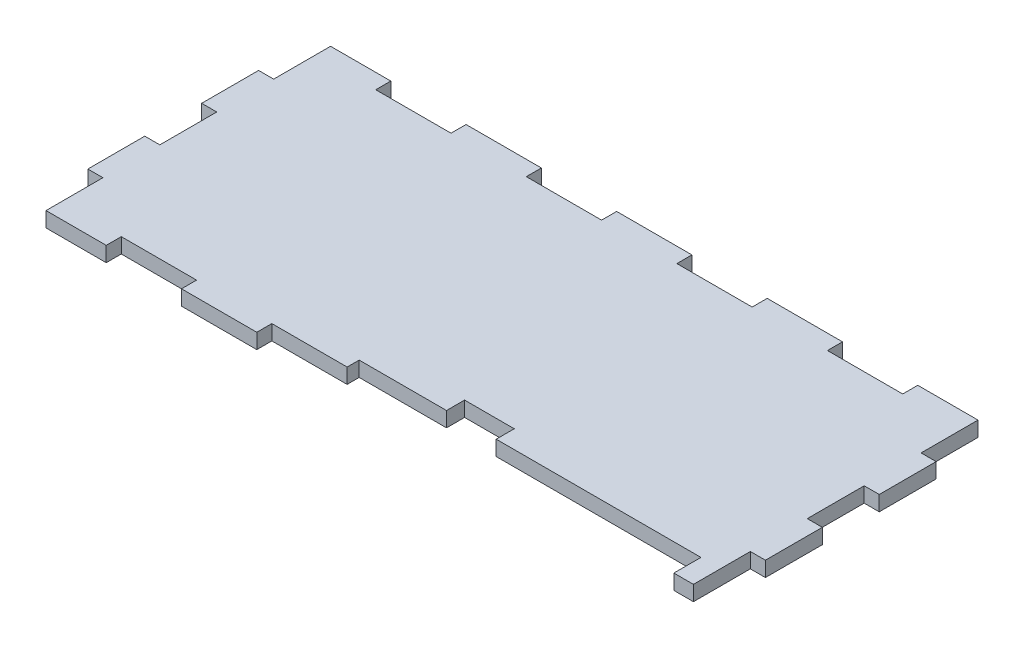
from build123d import *

# Parameters (mm, degrees)
SKETCH1_W           = 114.3
SKETCH1_H           = 48.006
BOSS_EXTRUDE1_DEPTH = 2.54
CUT_EXTRUDE2_REACH  = 64.038
SKETCH2_W           = 2.54
SKETCH2_H           = 9.6012
SKETCH2_W_2         = 12.7
SKETCH2_H_2         = 2.54
CUT_EXTRUDE3_DEPTH  = 2.54


with BuildPart() as part:
    # Sketch1 → Boss-Extrude1 (new body)
    with BuildSketch(Plane(origin=(0, 0, 0), x_dir=(1, 0, 0), z_dir=(0, 1, 0))):
        Rectangle(SKETCH1_W, SKETCH1_H)
    extrude(amount=BOSS_EXTRUDE1_DEPTH)

    # Sketch2 → Cut-Extrude2 (cut, up to next)
    with BuildSketch(Plane(origin=(0, 2.54, 0), x_dir=(1, 0, 0), z_dir=(0, 1, 0)), mode=Mode.PRIVATE) as cut_extrude2_sk1:
        with Locations((-55.88, 19.2024)):
            Rectangle(SKETCH2_W, SKETCH2_H)
    cut_extrude2_tool1 = extrude(cut_extrude2_sk1.sketch, amount=-CUT_EXTRUDE2_REACH, mode=Mode.PRIVATE) & part.part
    # Sketch2 → Cut-Extrude2 (cut, up to next)
    with BuildSketch(Plane(origin=(0, 2.54, 0), x_dir=(1, 0, 0), z_dir=(0, 1, 0)), mode=Mode.PRIVATE) as cut_extrude2_sk2:
        with Locations((-38.1, 22.733)):
            Rectangle(SKETCH2_W_2, SKETCH2_H_2)
    cut_extrude2_tool2 = extrude(cut_extrude2_sk2.sketch, amount=-CUT_EXTRUDE2_REACH, mode=Mode.PRIVATE) & part.part
    # Sketch2 → Cut-Extrude2 (cut, up to next)
    with BuildSketch(Plane(origin=(0, 2.54, 0), x_dir=(1, 0, 0), z_dir=(0, 1, 0)), mode=Mode.PRIVATE) as cut_extrude2_sk3:
        with Locations((-12.7, 22.733)):
            Rectangle(SKETCH2_W_2, SKETCH2_H_2)
    cut_extrude2_tool3 = extrude(cut_extrude2_sk3.sketch, amount=-CUT_EXTRUDE2_REACH, mode=Mode.PRIVATE) & part.part
    # Sketch2 → Cut-Extrude2 (cut, up to next)
    with BuildSketch(Plane(origin=(0, 2.54, 0), x_dir=(1, 0, 0), z_dir=(0, 1, 0)), mode=Mode.PRIVATE) as cut_extrude2_sk4:
        with Locations((12.7, 22.733)):
            Rectangle(SKETCH2_W_2, SKETCH2_H_2)
    cut_extrude2_tool4 = extrude(cut_extrude2_sk4.sketch, amount=-CUT_EXTRUDE2_REACH, mode=Mode.PRIVATE) & part.part
    # Sketch2 → Cut-Extrude2 (cut, up to next)
    with BuildSketch(Plane(origin=(0, 2.54, 0), x_dir=(1, 0, 0), z_dir=(0, 1, 0)), mode=Mode.PRIVATE) as cut_extrude2_sk5:
        with Locations((38.1, 22.733)):
            Rectangle(SKETCH2_W_2, SKETCH2_H_2)
    cut_extrude2_tool5 = extrude(cut_extrude2_sk5.sketch, amount=-CUT_EXTRUDE2_REACH, mode=Mode.PRIVATE) & part.part
    # Sketch2 → Cut-Extrude2 (cut, up to next)
    with BuildSketch(Plane(origin=(0, 2.54, 0), x_dir=(1, 0, 0), z_dir=(0, 1, 0)), mode=Mode.PRIVATE) as cut_extrude2_sk6:
        with Locations((55.88, 19.2024)):
            Rectangle(SKETCH2_W, SKETCH2_H)
    cut_extrude2_tool6 = extrude(cut_extrude2_sk6.sketch, amount=-CUT_EXTRUDE2_REACH, mode=Mode.PRIVATE) & part.part
    # Sketch2 → Cut-Extrude2 (cut, up to next)
    with BuildSketch(Plane(origin=(0, 2.54, 0), x_dir=(1, 0, 0), z_dir=(0, 1, 0)), mode=Mode.PRIVATE) as cut_extrude2_sk7:
        with Locations((55.88, 0)):
            Rectangle(SKETCH2_W, SKETCH2_H)
    cut_extrude2_tool7 = extrude(cut_extrude2_sk7.sketch, amount=-CUT_EXTRUDE2_REACH, mode=Mode.PRIVATE) & part.part
    # Sketch2 → Cut-Extrude2 (cut, up to next)
    with BuildSketch(Plane(origin=(0, 2.54, 0), x_dir=(1, 0, 0), z_dir=(0, 1, 0)), mode=Mode.PRIVATE) as cut_extrude2_sk8:
        with Locations((55.88, -19.2024)):
            Rectangle(SKETCH2_W, SKETCH2_H)
    cut_extrude2_tool8 = extrude(cut_extrude2_sk8.sketch, amount=-CUT_EXTRUDE2_REACH, mode=Mode.PRIVATE) & part.part
    # Sketch2 → Cut-Extrude2 (cut, up to next)
    with BuildSketch(Plane(origin=(0, 2.54, 0), x_dir=(1, 0, 0), z_dir=(0, 1, 0)), mode=Mode.PRIVATE) as cut_extrude2_sk9:
        with Locations((38.1, -22.733)):
            Rectangle(SKETCH2_W_2, SKETCH2_H_2)
    cut_extrude2_tool9 = extrude(cut_extrude2_sk9.sketch, amount=-CUT_EXTRUDE2_REACH, mode=Mode.PRIVATE) & part.part
    # Sketch2 → Cut-Extrude2 (cut, up to next)
    with BuildSketch(Plane(origin=(0, 2.54, 0), x_dir=(1, 0, 0), z_dir=(0, 1, 0)), mode=Mode.PRIVATE) as cut_extrude2_sk10:
        with Locations((12.7, -22.733)):
            Rectangle(SKETCH2_W_2, SKETCH2_H_2)
    cut_extrude2_tool10 = extrude(cut_extrude2_sk10.sketch, amount=-CUT_EXTRUDE2_REACH, mode=Mode.PRIVATE) & part.part
    # Sketch2 → Cut-Extrude2 (cut, up to next)
    with BuildSketch(Plane(origin=(0, 2.54, 0), x_dir=(1, 0, 0), z_dir=(0, 1, 0)), mode=Mode.PRIVATE) as cut_extrude2_sk11:
        with Locations((-12.7, -22.733)):
            Rectangle(SKETCH2_W_2, SKETCH2_H_2)
    cut_extrude2_tool11 = extrude(cut_extrude2_sk11.sketch, amount=-CUT_EXTRUDE2_REACH, mode=Mode.PRIVATE) & part.part
    # Sketch2 → Cut-Extrude2 (cut, up to next)
    with BuildSketch(Plane(origin=(0, 2.54, 0), x_dir=(1, 0, 0), z_dir=(0, 1, 0)), mode=Mode.PRIVATE) as cut_extrude2_sk12:
        with Locations((-38.1, -22.733)):
            Rectangle(SKETCH2_W_2, SKETCH2_H_2)
    cut_extrude2_tool12 = extrude(cut_extrude2_sk12.sketch, amount=-CUT_EXTRUDE2_REACH, mode=Mode.PRIVATE) & part.part
    # Sketch2 → Cut-Extrude2 (cut, up to next)
    with BuildSketch(Plane(origin=(0, 2.54, 0), x_dir=(1, 0, 0), z_dir=(0, 1, 0)), mode=Mode.PRIVATE) as cut_extrude2_sk13:
        with Locations((-55.88, -19.2024)):
            Rectangle(SKETCH2_W, SKETCH2_H)
    cut_extrude2_tool13 = extrude(cut_extrude2_sk13.sketch, amount=-CUT_EXTRUDE2_REACH, mode=Mode.PRIVATE) & part.part
    # Sketch2 → Cut-Extrude2 (cut, up to next)
    with BuildSketch(Plane(origin=(0, 2.54, 0), x_dir=(1, 0, 0), z_dir=(0, 1, 0)), mode=Mode.PRIVATE) as cut_extrude2_sk14:
        with Locations((-55.88, 0)):
            Rectangle(SKETCH2_W, SKETCH2_H)
    cut_extrude2_tool14 = extrude(cut_extrude2_sk14.sketch, amount=-CUT_EXTRUDE2_REACH, mode=Mode.PRIVATE) & part.part
    add(cut_extrude2_tool1.solids().sort_by_distance((-55.88, 2.54, -19.2024))[0], mode=Mode.SUBTRACT)
    add(cut_extrude2_tool2.solids().sort_by_distance((-38.1, 2.54, -22.733))[0], mode=Mode.SUBTRACT)
    add(cut_extrude2_tool3.solids().sort_by_distance((-12.7, 2.54, -22.733))[0], mode=Mode.SUBTRACT)
    add(cut_extrude2_tool4.solids().sort_by_distance((12.7, 2.54, -22.733))[0], mode=Mode.SUBTRACT)
    add(cut_extrude2_tool5.solids().sort_by_distance((38.1, 2.54, -22.733))[0], mode=Mode.SUBTRACT)
    add(cut_extrude2_tool6.solids().sort_by_distance((55.88, 2.54, -19.2024))[0], mode=Mode.SUBTRACT)
    add(cut_extrude2_tool7.solids().sort_by_distance((55.88, 2.54, 0))[0], mode=Mode.SUBTRACT)
    add(cut_extrude2_tool8.solids().sort_by_distance((55.88, 2.54, 19.2024))[0], mode=Mode.SUBTRACT)
    add(cut_extrude2_tool9.solids().sort_by_distance((38.1, 2.54, 22.733))[0], mode=Mode.SUBTRACT)
    add(cut_extrude2_tool10.solids().sort_by_distance((12.7, 2.54, 22.733))[0], mode=Mode.SUBTRACT)
    add(cut_extrude2_tool11.solids().sort_by_distance((-12.7, 2.54, 22.733))[0], mode=Mode.SUBTRACT)
    add(cut_extrude2_tool12.solids().sort_by_distance((-38.1, 2.54, 22.733))[0], mode=Mode.SUBTRACT)
    add(cut_extrude2_tool13.solids().sort_by_distance((-55.88, 2.54, 19.2024))[0], mode=Mode.SUBTRACT)
    add(cut_extrude2_tool14.solids().sort_by_distance((-55.88, 2.54, 0))[0], mode=Mode.SUBTRACT)

    # Sketch5 → Cut-Extrude3 (cut)
    with BuildSketch(Plane(origin=(0, 2.54, 0), x_dir=(1, 0, 0), z_dir=(0, 1, 0))):
        Polygon((16.764, -19.431), (51.308, -19.431), (51.308, -24.003), (-6.35, -24.003), (-6.35, -19.431), (8.382, -19.431), (8.382, -16.383), (16.764, -16.383), align=None)
    extrude(amount=-CUT_EXTRUDE3_DEPTH, mode=Mode.SUBTRACT)


solid = part.part
